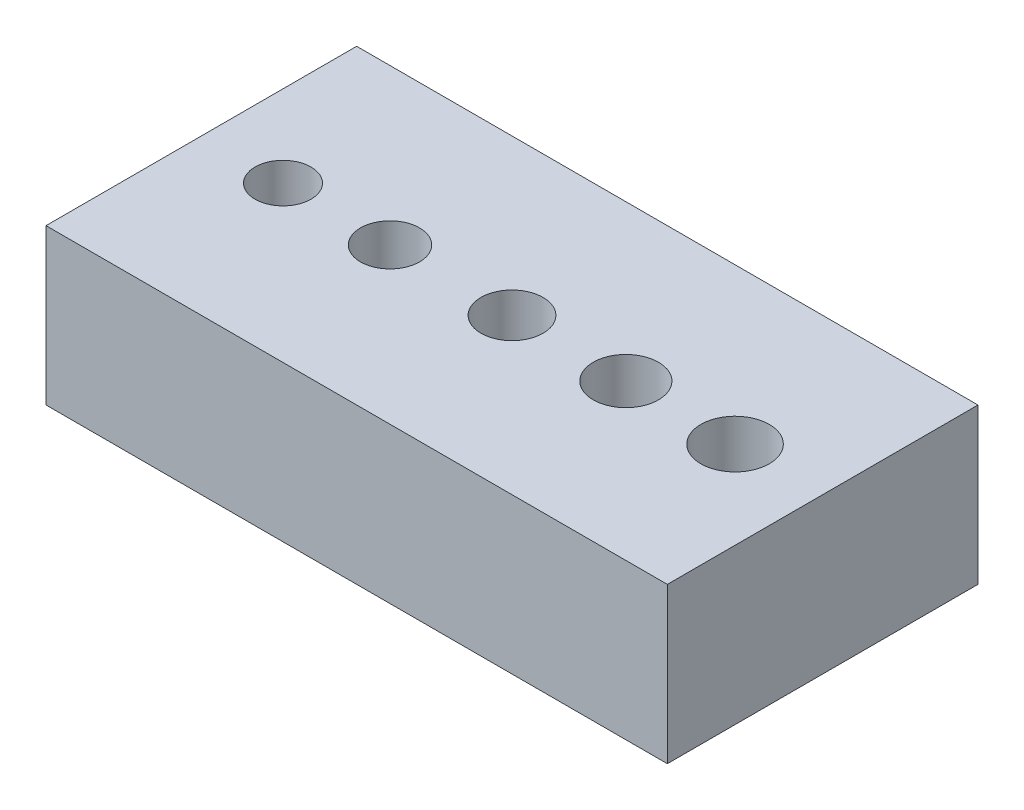
from build123d import *

# Parameters (mm, degrees)
SKETCH_1_W      = 20
SKETCH_1_H      = 10
SKETCH_1_R      = 1
SKETCH_1_R_2    = 0.95
SKETCH_1_R_3    = 1.05
SKETCH_1_R_4    = 1.1
SKETCH_1_R_5    = 0.9
EXTRUDE_1_DEPTH = 5


with BuildPart() as part:
    # 草图1 → 凸台-拉伸1 (new body)
    with BuildSketch(Plane(origin=(0, 0, 0), x_dir=(1, 0, 0), z_dir=(0, 1, 0))):
        Rectangle(SKETCH_1_W, SKETCH_1_H)
        with Locations(Location((0, 0, 0), (0, 0, 270))):
            Circle(SKETCH_1_R, mode=Mode.SUBTRACT)
        with Locations(Location((-3.926893878, 0, 0), (0, 0, 270))):
            Circle(SKETCH_1_R_2, mode=Mode.SUBTRACT)
        with Locations(Location((3.665065306, 0, 0), (0, 0, 270))):
            Circle(SKETCH_1_R_3, mode=Mode.SUBTRACT)
        with Locations(Location((7.179861224, 0, 0), (0, 0, 270))):
            Circle(SKETCH_1_R_4, mode=Mode.SUBTRACT)
        with Locations(Location((-7.371393878, 0, 0), (0, 0, 270))):
            Circle(SKETCH_1_R_5, mode=Mode.SUBTRACT)
    extrude(amount=EXTRUDE_1_DEPTH)


solid = part.part
